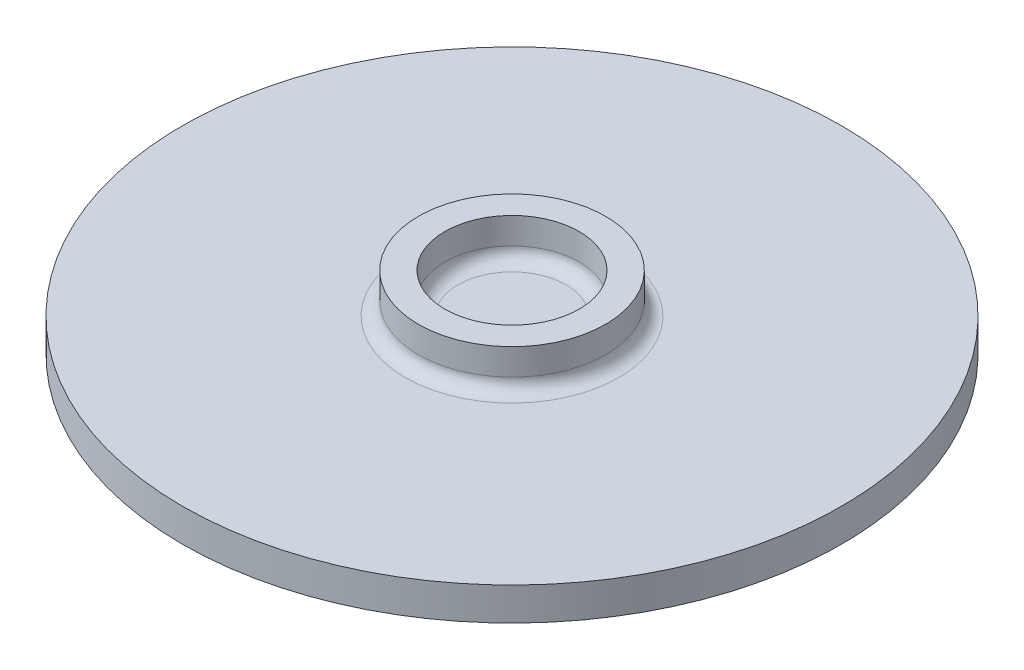
from build123d import *

# Parameters (mm, degrees)
SKETCH2_R           = 25
SKETCH2_R_2         = 5.1
BOSS_EXTRUDE1_DEPTH = 2.5
SKETCH3_R           = 7.1
SKETCH3_R_2         = 5.1
BOSS_EXTRUDE2_DEPTH = 3
FILLET1_R           = 1
FILLET2_R           = 1


with BuildPart() as part:
    # Sketch2 → Boss-Extrude1 (new body)
    # profile 1 of 2: a face of its own
    with BuildSketch(Plane(origin=(0, 0, 0), x_dir=(1, 0, 0), z_dir=(0, 1, 0))):
        with Locations(Location((0, 0, 0), (0, 0, 270))):
            Circle(SKETCH2_R)
        Circle(SKETCH2_R_2, mode=Mode.SUBTRACT)
    # profile 2 of 2: a face of its own
    with BuildSketch(Plane(origin=(0, 0, 0), x_dir=(1, 0, 0), z_dir=(0, 1, 0))):
        Circle(SKETCH2_R_2)
    extrude(amount=BOSS_EXTRUDE1_DEPTH)

    # Sketch3 → Boss-Extrude2 (add)
    with BuildSketch(Plane(origin=(0, 2.5, 0), x_dir=(1, 0, 0), z_dir=(0, 1, 0))):
        with Locations(Location((0, 0, 0), (0, 0, 270))):
            Circle(SKETCH3_R)
        with Locations(Location((0, 0, 0), (0, 0, 270))):
            Circle(SKETCH3_R_2, mode=Mode.SUBTRACT)
    extrude(amount=BOSS_EXTRUDE2_DEPTH)

    # Fillet1
    fillet1_edges = [part.edges().sort_by_distance(p)[0] for p in [
        (0, 2.5, -5.1),
    ]]
    fillet(fillet1_edges, radius=FILLET1_R)

    # Fillet2
    fillet2_edges = [part.edges().sort_by_distance(p)[0] for p in [
        (0, 2.5, -7.1),
    ]]
    fillet(fillet2_edges, radius=FILLET2_R)


solid = part.part
